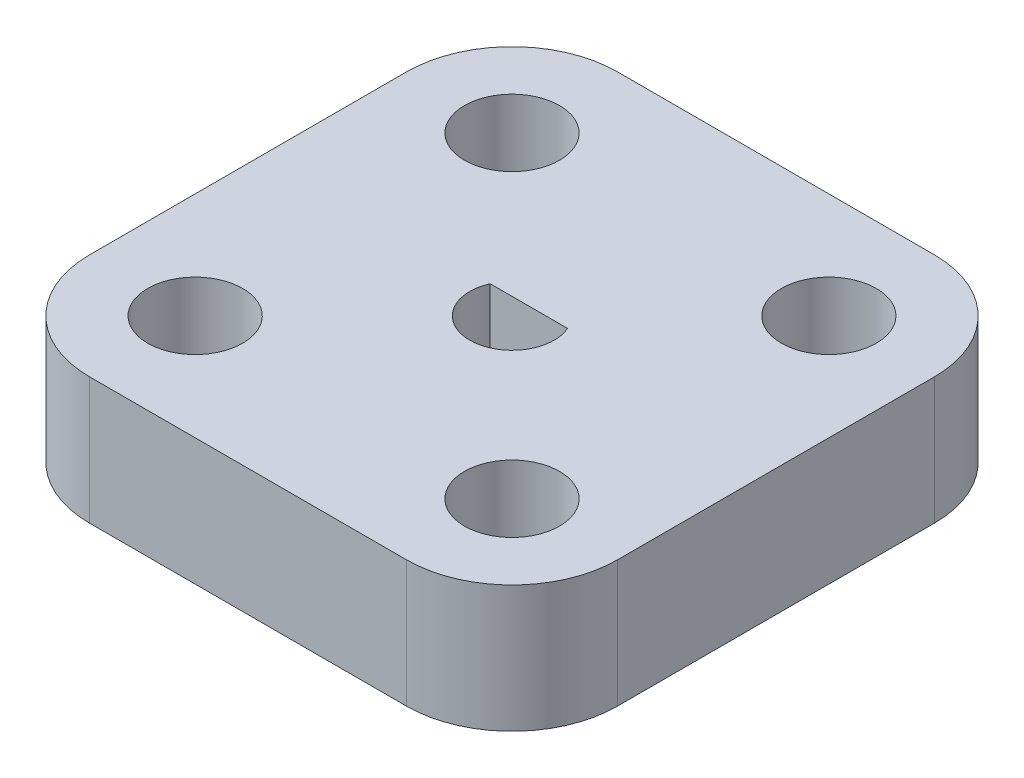
from build123d import *

# Parameters (mm, degrees)
BOSS_EXTRUDE1_DEPTH   = 6
F_8_CLEARANCE_HOLE1_D = 4.4958


with BuildPart() as part:
    # Sketch1 → Boss-Extrude1 (new body)
    with BuildSketch(Plane(origin=(0, 0, 0), x_dir=(1, 0, 0), z_dir=(0, 1, 0))):
        with BuildLine():
            Line((7.5, 12.5), (-7.5, 12.5))
            ThreePointArc((-7.5, 12.5), (-11.035533906, 11.035533906), (-12.5, 7.5))
            Line((-12.5, 7.5), (-12.5, -7.5))
            ThreePointArc((-12.5, -7.5), (-11.035533906, -11.035533906), (-7.5, -12.5))
            Line((-7.5, -12.5), (7.5, -12.5))
            ThreePointArc((7.5, -12.5), (11.035533906, -11.035533906), (12.5, -7.5))
            Line((12.5, -7.5), (12.5, 7.5))
            ThreePointArc((12.5, 7.5), (11.035533906, 11.035533906), (7.5, 12.5))
        make_face()
        with BuildLine():
            Line((-1.833030278, 0.8), (1.833030278, 0.8))
            ThreePointArc((1.833030278, 0.8), (0, -2), (-1.833030278, 0.8))
        make_face(mode=Mode.SUBTRACT)
    extrude(amount=BOSS_EXTRUDE1_DEPTH)

    # #8 Clearance Hole1 (through all)
    with Locations(Plane(origin=(0, 6, 0), x_dir=(1, 0, 0), z_dir=(0, 1, 0))):
        with Locations((-7.5, 7.5), (7.5, 7.5), (-7.5, -7.5), (7.5, -7.5)):
            Hole(F_8_CLEARANCE_HOLE1_D / 2)


solid = part.part
